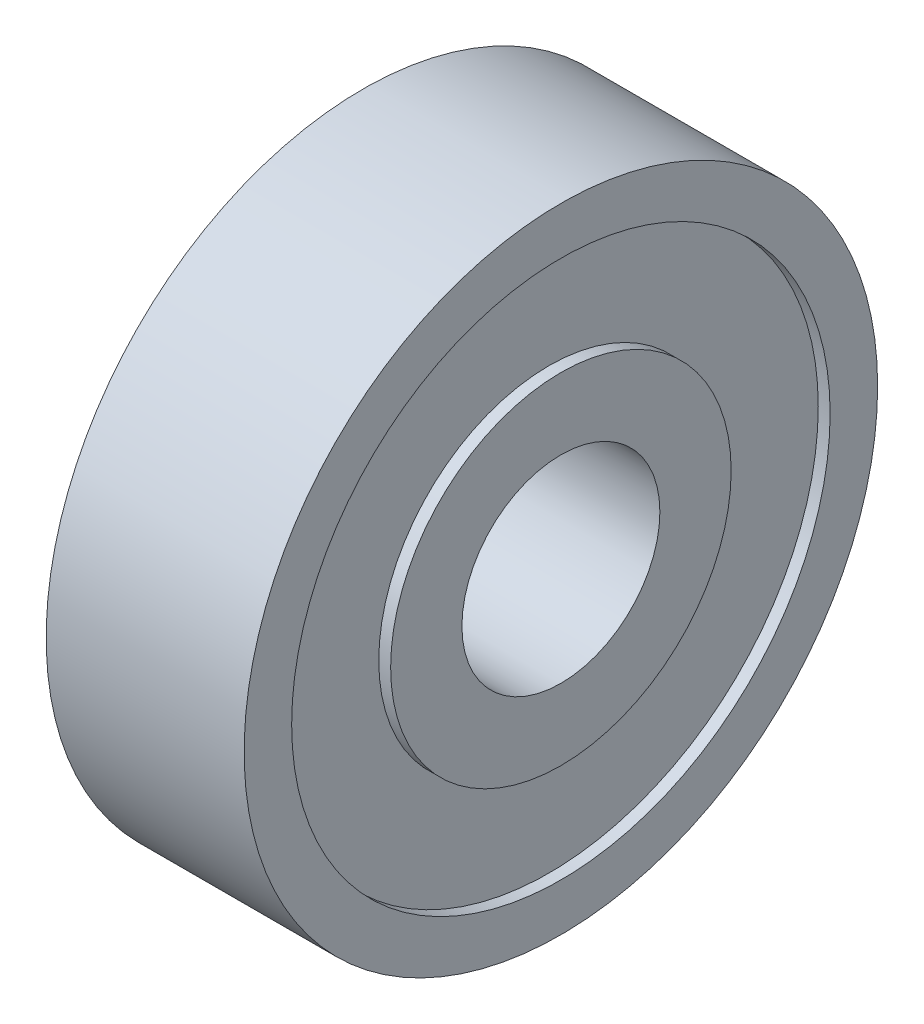
from build123d import *


with BuildPart() as part:
    # Sketch1 → Revolve1 (revolve)
    with BuildSketch(Plane.XY, mode=Mode.PRIVATE) as revolve1_sk:
        Polygon((2.5, 2.5), (-2.5, 2.5), (-2.5, 4.3), (-2.2, 4.3), (-2.2, 6.8), (-2.5, 6.8), (-2.5, 8), (2.5, 8), (2.5, 6.8), (2.2, 6.8), (2.2, 4.3), (2.5, 4.3), align=None)
    revolve(revolve1_sk.sketch.rotate(Axis((0, 0, 0), (-1, 0, 0)), 90), axis=Axis((0, 0, 0), (-1, 0, 0)))


solid = part.part
